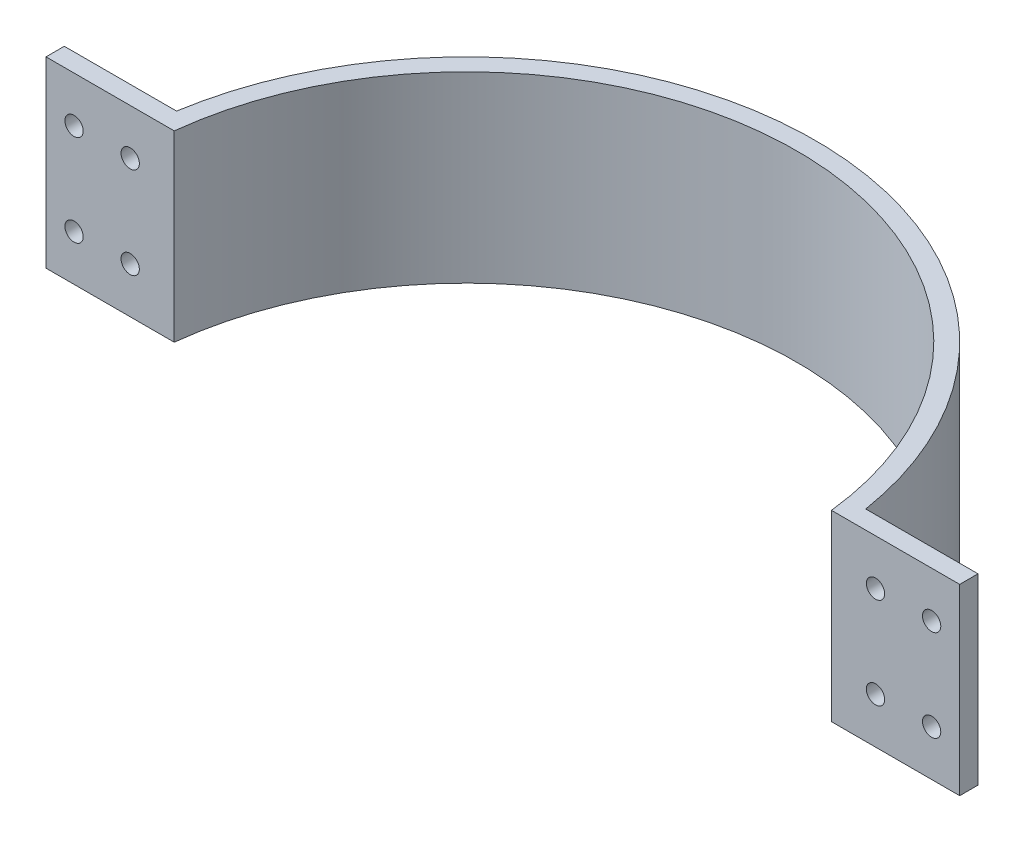
from build123d import *

# Parameters (mm, degrees)
BOSS_EXTRUDE1_DEPTH = 31.75
SKETCH2_R           = 3.175
CUT_EXTRUDE1_DEPTH  = 195.587542385


with BuildPart() as part:
    # Sketch1 → Boss-Extrude1 (new, symmetric)
    with BuildSketch(Plane(origin=(0, 0, 0), x_dir=(1, 0, 0), z_dir=(0, 1, 0))):
        with BuildLine():
            ThreePointArc((119.54162455, 19.05), (0, 121.05), (-119.54162455, 19.05))
            Line((-119.54162455, 19.05), (-158.481944244, 19.05))
            Line((-158.481944244, 19.05), (-158.481944244, 12.7))
            Line((-158.481944244, 12.7), (-120.381944244, 12.7))
            Line((-120.381944244, 12.7), (-113.994736721, 12.7))
            ThreePointArc((-113.994736721, 12.7), (0, 114.7), (113.994736721, 12.7))
            Line((113.994736721, 12.7), (120.381944244, 12.7))
            Line((120.381944244, 12.7), (158.481944244, 12.7))
            Line((158.481944244, 12.7), (158.481944244, 19.05))
            Line((158.481944244, 19.05), (119.54162455, 19.05))
        make_face()
    extrude(amount=BOSS_EXTRUDE1_DEPTH, both=True)

    # Sketch2 → Cut-Extrude1 (cut, through all)
    with BuildSketch(Plane.XY.offset(-12.7)):
        with Locations((-129.276704473, 15.875)):
            Circle(SKETCH2_R)
        with Locations((-148.746864321, 15.875)):
            Circle(SKETCH2_R)
        with Locations((-148.746864321, -15.875)):
            Circle(SKETCH2_R)
        with Locations((-129.276704473, -15.875)):
            Circle(SKETCH2_R)
        with Locations((129.276704473, 15.875)):
            Circle(SKETCH2_R)
        with Locations((148.746864321, 15.875)):
            Circle(SKETCH2_R)
        with Locations((129.276704473, -15.875)):
            Circle(SKETCH2_R)
        with Locations((148.746864321, -15.875)):
            Circle(SKETCH2_R)
    extrude(amount=-CUT_EXTRUDE1_DEPTH, mode=Mode.SUBTRACT)


solid = part.part
